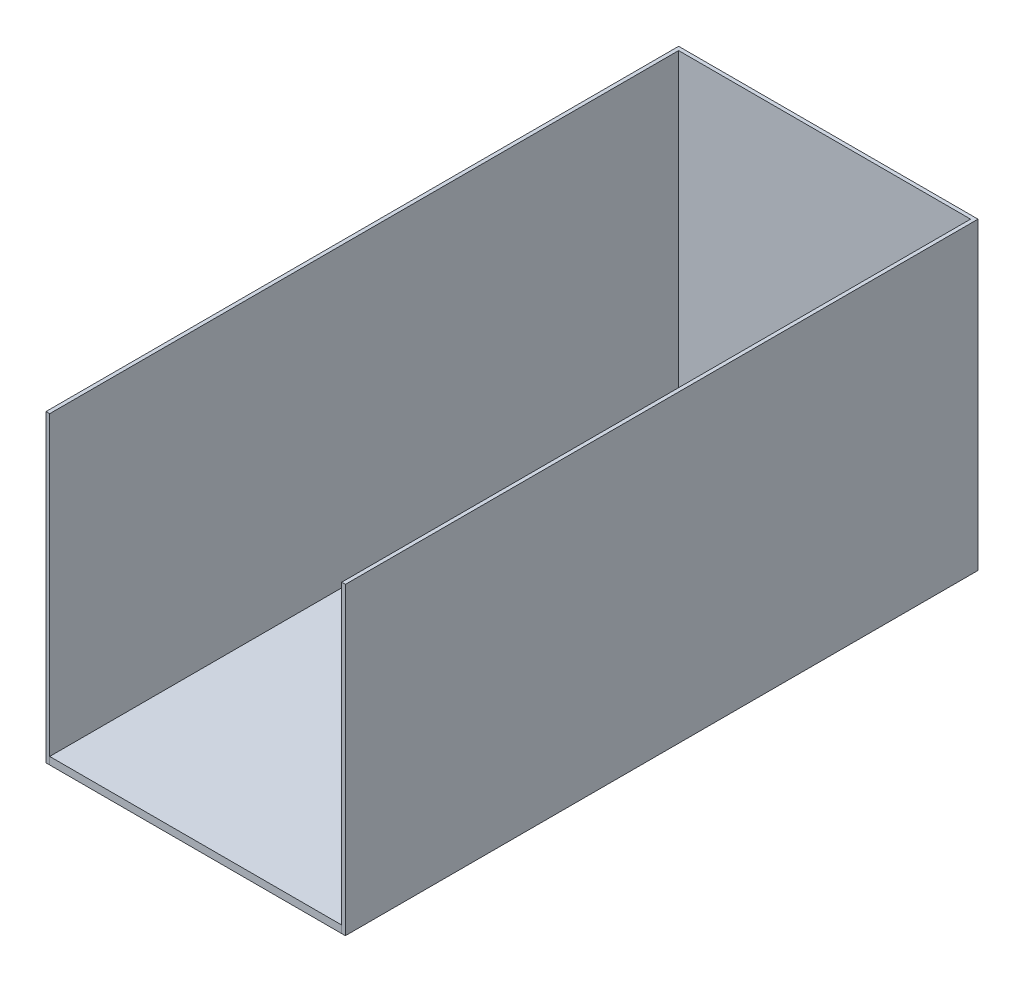
from build123d import *

# Parameters (mm, degrees)
SKETCH1_W           = 1967
SKETCH1_H           = 4237
BOSS_EXTRUDE1_DEPTH = 50
BOSS_EXTRUDE2_DEPTH = 2050


with BuildPart() as part:
    # Sketch1 → Boss-Extrude1 (new body)
    with BuildSketch(Plane(origin=(0, 0, 0), x_dir=(1, 0, 0), z_dir=(0, 1, 0))):
        with Locations((983.5, 2118.5)):
            Rectangle(SKETCH1_W, SKETCH1_H)
    extrude(amount=BOSS_EXTRUDE1_DEPTH)


with BuildPart() as body_2:
    # Sketch1<7> → Boss-Extrude2 (new body)
    with BuildSketch(Plane(origin=(0, 0, 0), x_dir=(1, 0, 0), z_dir=(0, 1, 0))):
        Polygon((1967, 0), (1992, 0), (1992, 4262), (-25, 4262), (-25, 0), (0, 0), (0, 4237), (1967, 4237), align=None)
    extrude(amount=BOSS_EXTRUDE2_DEPTH)


solid = Compound([part.part, body_2.part])
